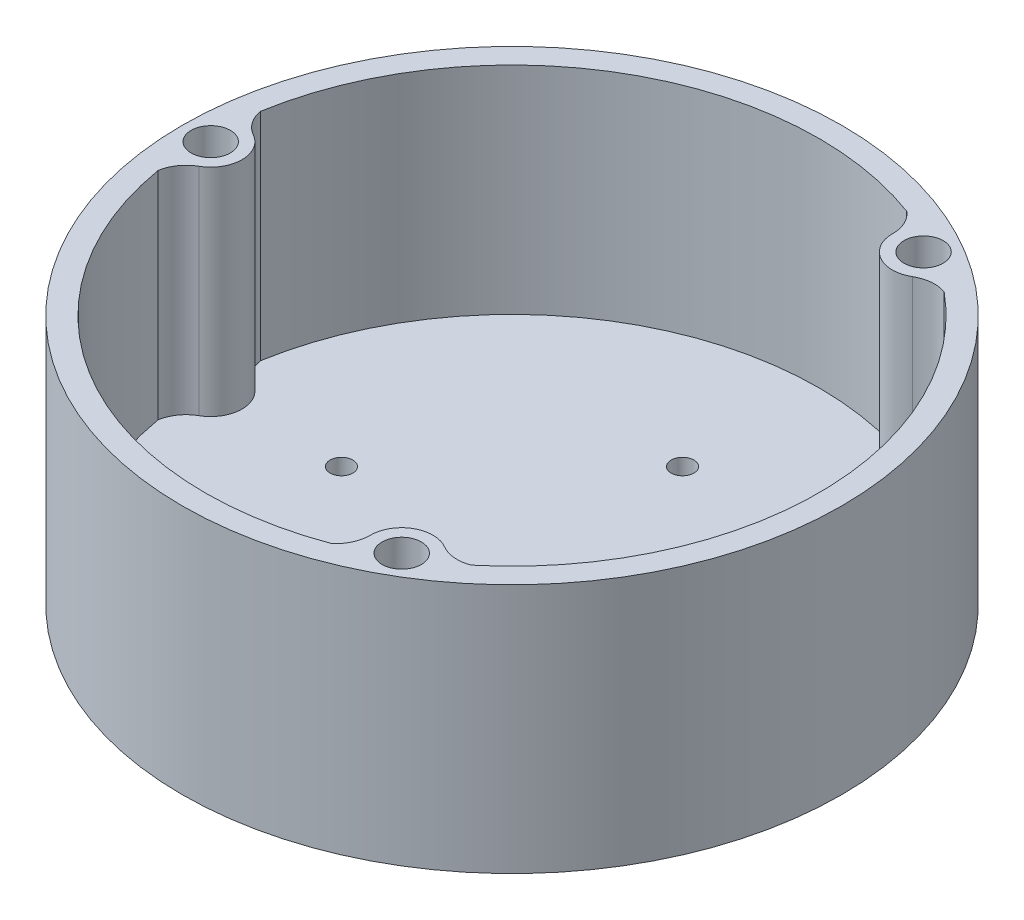
from build123d import *

# Parameters (mm, degrees)
SKETCH1_R           = 29
BOSS_EXTRUDE1_DEPTH = 22
SKETCH1_5_R         = 1
BOSS_EXTRUDE2_DEPTH = 3
CUT_EXTRUDE1_START  = 22
SKETCH1_6_R         = 1.725
CUT_EXTRUDE1_DEPTH  = 3


with BuildPart() as part:
    # Sketch1 → Boss-Extrude1 (new body)
    with BuildSketch(Plane(origin=(0, 0, 0), x_dir=(1, 0, 0), z_dir=(0, 1, 0))):
        with Locations(Location((0, 0, 0), (0, 0, 270))):
            Circle(SKETCH1_R)
        with BuildLine():
            ThreePointArc((9.414065195, 25.305639223), (-13.5, 23.382685902), (-26.622359024, 4.5))
            ThreePointArc((-26.622359024, 4.5), (-26.120735258, 3.279582529), (-25.143996734, 2.392437072))
            ThreePointArc((-25.143996734, 2.392437072), (-23.75, 0), (-25.143996734, -2.392437072))
            ThreePointArc((-25.143996734, -2.392437072), (-26.120735258, -3.279582529), (-26.622359024, -4.5))
            ThreePointArc((-26.622359024, -4.5), (-13.5, -23.382685902), (9.414065195, -25.305639223))
            ThreePointArc((9.414065195, -25.305639223), (10.220165845, -24.261011563), (10.500087086, -22.971558461))
            ThreePointArc((10.500087086, -22.971558461), (11.875, -20.56810334), (14.643909648, -20.579121389))
            ThreePointArc((14.643909648, -20.579121389), (15.900569413, -20.981429034), (17.208293829, -20.805639223))
            ThreePointArc((17.208293829, -20.805639223), (27, 0), (17.208293829, 20.805639223))
            ThreePointArc((17.208293829, 20.805639223), (15.900569413, 20.981429034), (14.643909648, 20.579121389))
            ThreePointArc((14.643909648, 20.579121389), (11.875, 20.56810334), (10.500087086, 22.971558461))
            ThreePointArc((10.500087086, 22.971558461), (10.220165845, 24.261011563), (9.414065195, 25.305639223))
        make_face(mode=Mode.SUBTRACT)
    extrude(amount=BOSS_EXTRUDE1_DEPTH)

    # Sketch1<5> → Boss-Extrude2 (add)
    with BuildSketch(Plane(origin=(0, 0, 0), x_dir=(1, 0, 0), z_dir=(0, 1, 0))):
        with BuildLine():
            ThreePointArc((-26.622359024, -4.5), (-26.120735258, -3.279582529), (-25.143996734, -2.392437072))
            ThreePointArc((-25.143996734, -2.392437072), (-23.75, 0), (-25.143996734, 2.392437072))
            ThreePointArc((-25.143996734, 2.392437072), (-26.120735258, 3.279582529), (-26.622359024, 4.5))
            ThreePointArc((-26.622359024, 4.5), (-13.5, 23.382685902), (9.414065195, 25.305639223))
            ThreePointArc((9.414065195, 25.305639223), (10.220165845, 24.261011563), (10.500087086, 22.971558461))
            ThreePointArc((10.500087086, 22.971558461), (11.875, 20.56810334), (14.643909648, 20.579121389))
            ThreePointArc((14.643909648, 20.579121389), (15.900569413, 20.981429034), (17.208293829, 20.805639223))
            ThreePointArc((17.208293829, 20.805639223), (27, 0), (17.208293829, -20.805639223))
            ThreePointArc((17.208293829, -20.805639223), (15.900569413, -20.981429034), (14.643909648, -20.579121389))
            ThreePointArc((14.643909648, -20.579121389), (11.875, -20.56810334), (10.500087086, -22.971558461))
            ThreePointArc((10.500087086, -22.971558461), (10.220165845, -24.261011563), (9.414065195, -25.305639223))
            ThreePointArc((9.414065195, -25.305639223), (-13.5, -23.382685902), (-26.622359024, -4.5))
        make_face()
        with Locations(Location((0, 15, 0), (0, 0, 270))):
            Circle(SKETCH1_5_R, mode=Mode.SUBTRACT)
        with Locations(Location((15, 0, 0), (0, 0, 270))):
            Circle(SKETCH1_5_R, mode=Mode.SUBTRACT)
        with Locations(Location((0, -15, 0), (0, 0, 270))):
            Circle(SKETCH1_5_R, mode=Mode.SUBTRACT)
        with Locations(Location((-15, 0, 0), (0, 0, 270))):
            Circle(SKETCH1_5_R, mode=Mode.SUBTRACT)
    extrude(amount=BOSS_EXTRUDE2_DEPTH)

    # Sketch1<6> → Cut-Extrude1 (cut)
    with BuildSketch(Plane(origin=(0, 0, 0), x_dir=(1, 0, 0), z_dir=(0, 1, 0)).offset(CUT_EXTRUDE1_START)):
        with Locations(Location((13.25, 22.9496732, 0), (0, 0, 270))):
            Circle(SKETCH1_6_R)
        with Locations(Location((13.25, -22.9496732, 0), (0, 0, 270))):
            Circle(SKETCH1_6_R)
        with Locations(Location((-26.5, 0, 0), (0, 0, 270))):
            Circle(SKETCH1_6_R)
    extrude(amount=-CUT_EXTRUDE1_DEPTH, mode=Mode.SUBTRACT)


solid = part.part
